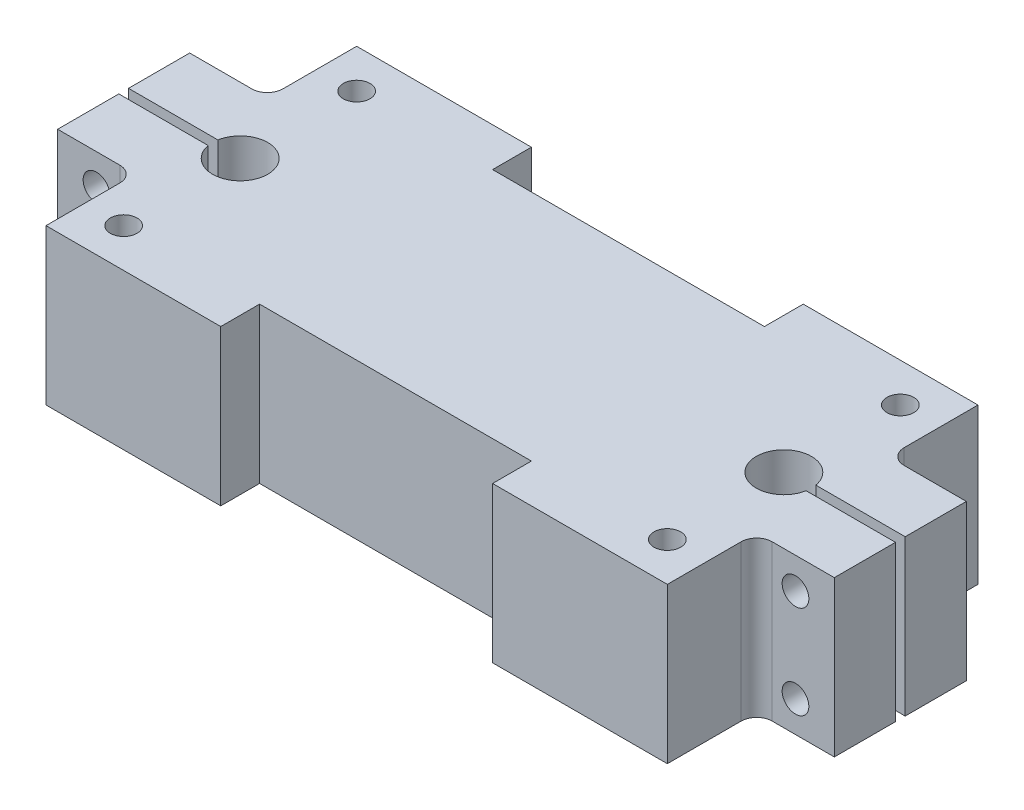
from build123d import *

# Parameters (mm, degrees)
SKETCH1_W                            = 127
SKETCH1_H                            = 50.8
BOSS_EXTRUDE1_DEPTH                  = 25.4
SKETCH2_R                            = 4.5085
CUT_EXTRUDE1_DEPTH                   = 73.955945611
SKETCH3_W                            = 19.05
SKETCH3_H                            = 1.5875
CUT_EXTRUDE2_DEPTH                   = 73.955945611
SKETCH4_W                            = 12.7
SKETCH4_H                            = 14.605
CUT_EXTRUDE3_DEPTH                   = 73.955945611
F_11_64_0_17188_DIAMETER_HOLE1_D     = 4.365752
F_11_64_0_17188_DIAMETER_HOLE1_DEPTH = 25.4
F_11_64_0_17188_DIAMETER_HOLE1_TIP   = 1.311604225
FILLET3_R                            = 2.54
F_11_64_0_17188_DIAMETER_HOLE2_D     = 4.365752
F_11_64_0_17188_DIAMETER_HOLE2_DEPTH = 25.4
F_11_64_0_17188_DIAMETER_HOLE2_TIP   = 1.311604225
SKETCH9_W                            = 44.45
SKETCH9_H                            = 6.35
CUT_EXTRUDE4_DEPTH                   = 73.955945611


with BuildPart() as part:
    # Sketch1 → Boss-Extrude1 (new body)
    with BuildSketch(Plane(origin=(0, 0, 0), x_dir=(1, 0, 0), z_dir=(0, 1, 0))):
        Rectangle(SKETCH1_W, SKETCH1_H)
    extrude(amount=BOSS_EXTRUDE1_DEPTH)

    # Sketch2 → Cut-Extrude1 (cut, through all)
    with BuildSketch(Plane(origin=(0, 25.4, 0), x_dir=(1, 0, 0), z_dir=(0, 1, 0))):
        with Locations(Location((-44.45, 0, 0), (0, 0, 270))):
            Circle(SKETCH2_R)
        with Locations(Location((44.45, 0, 0), (0, 0, 270))):
            Circle(SKETCH2_R)
    extrude(amount=-CUT_EXTRUDE1_DEPTH, mode=Mode.SUBTRACT)

    # Sketch3 → Cut-Extrude2 (cut, through all)
    with BuildSketch(Plane(origin=(0, 25.4, 0), x_dir=(1, 0, 0), z_dir=(0, 1, 0))):
        with Locations((-53.975, 0)):
            Rectangle(SKETCH3_W, SKETCH3_H)
        with Locations((53.975, 0)):
            Rectangle(SKETCH3_W, SKETCH3_H)
    extrude(amount=-CUT_EXTRUDE2_DEPTH, mode=Mode.SUBTRACT)

    # Sketch4 → Cut-Extrude3 (cut, through all)
    with BuildSketch(Plane(origin=(0, 25.4, 0), x_dir=(1, 0, 0), z_dir=(0, 1, 0))):
        with Locations((-57.15, -18.0975)):
            Rectangle(SKETCH4_W, SKETCH4_H)
        with Locations((-57.15, 18.0975)):
            Rectangle(SKETCH4_W, SKETCH4_H)
        with Locations((57.15, 18.0975)):
            Rectangle(SKETCH4_W, SKETCH4_H)
        with Locations((57.15, -18.0975)):
            Rectangle(SKETCH4_W, SKETCH4_H)
    extrude(amount=-CUT_EXTRUDE3_DEPTH, mode=Mode.SUBTRACT)

    # 11/64 (0.17188) Diameter Hole1
    with Locations(Plane(origin=(-57.15, 20.32, 10.795), x_dir=(1, 0, 0), z_dir=(0, 0, 1))):
        with Locations((0, 0), (0, -15.24), (114.3, 0), (114.3, -15.24)):
            Hole(F_11_64_0_17188_DIAMETER_HOLE1_D / 2, depth=F_11_64_0_17188_DIAMETER_HOLE1_DEPTH)
            with Locations((0, 0, -(F_11_64_0_17188_DIAMETER_HOLE1_DEPTH + F_11_64_0_17188_DIAMETER_HOLE1_TIP / 2))):  # 118° drill point
                Cone(0, F_11_64_0_17188_DIAMETER_HOLE1_D / 2, F_11_64_0_17188_DIAMETER_HOLE1_TIP, mode=Mode.SUBTRACT)

    # Fillet3
    fillet3_edges = [part.edges().sort_by_distance(p)[0] for p in [
        (50.8, 12.7, 10.795),
        (-50.8, 12.7, 10.795),
        (-50.8, 12.7, -10.795),
        (50.8, 12.7, -10.795),
    ]]
    fillet(fillet3_edges, radius=FILLET3_R)

    # 11/64 (0.17188) Diameter Hole2
    with Locations(Plane(origin=(-44.45, 25.4, -19.05), x_dir=(0, 0, 1), z_dir=(0, 1, 0))):
        with Locations((0, 0), (38.1, 0), (38.1, 88.9), (0, 88.9)):
            Hole(F_11_64_0_17188_DIAMETER_HOLE2_D / 2, depth=F_11_64_0_17188_DIAMETER_HOLE2_DEPTH)
            with Locations((0, 0, -(F_11_64_0_17188_DIAMETER_HOLE2_DEPTH + F_11_64_0_17188_DIAMETER_HOLE2_TIP / 2))):  # 118° drill point
                Cone(0, F_11_64_0_17188_DIAMETER_HOLE2_D / 2, F_11_64_0_17188_DIAMETER_HOLE2_TIP, mode=Mode.SUBTRACT)

    # Sketch9 → Cut-Extrude4 (cut, through all)
    with BuildSketch(Plane(origin=(0, 25.4, 0), x_dir=(1, 0, 0), z_dir=(0, 1, 0))):
        with Locations((0, -22.225)):
            Rectangle(SKETCH9_W, SKETCH9_H)
        with Locations((0, 22.225)):
            Rectangle(SKETCH9_W, SKETCH9_H)
    extrude(amount=-CUT_EXTRUDE4_DEPTH, mode=Mode.SUBTRACT)


solid = part.part
